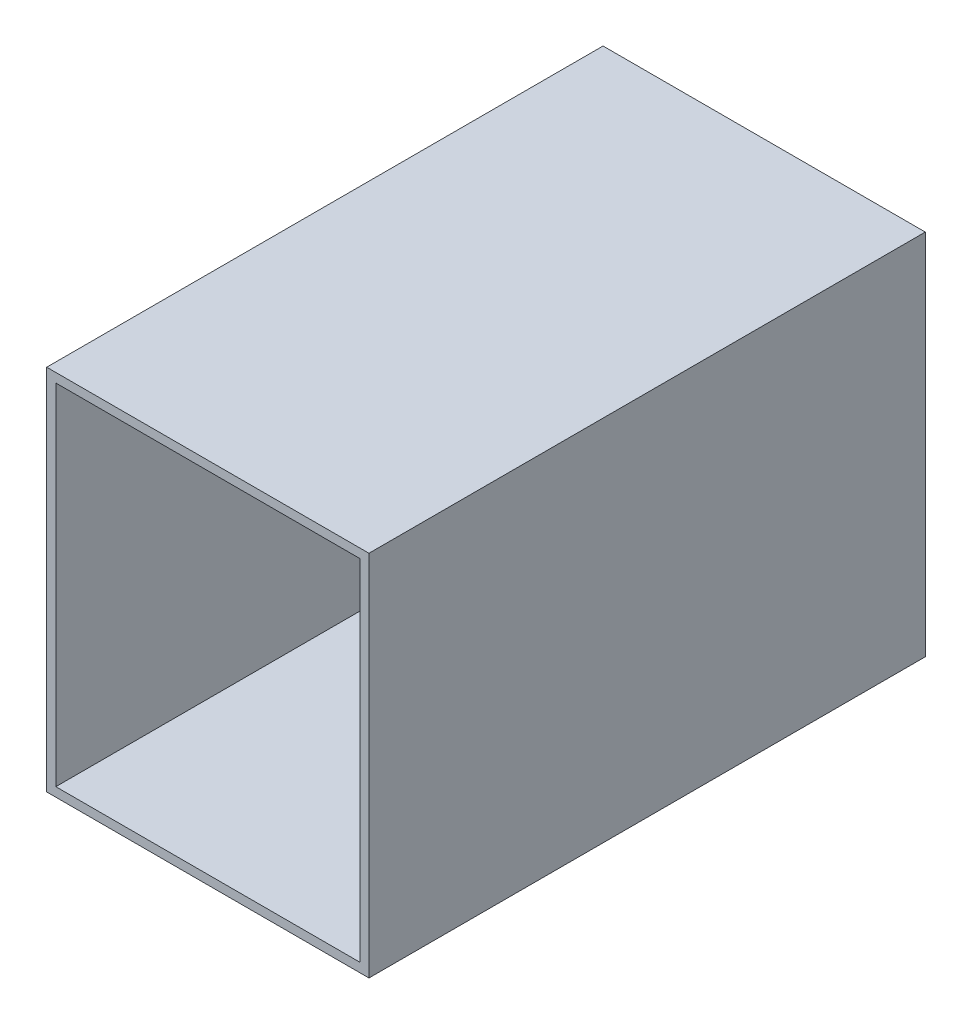
from build123d import *

# Parameters (mm, degrees)
SKETCH_1_W         = 106
SKETCH_1_H         = 121
BLOCKEXTRUDE_DEPTH = 183
SHELL_1_T          = -3


with BuildPart() as part:
    # 草图1 → BlockExtrude (new body)
    with BuildSketch(Plane.XY):
        with Locations((53, 60.5)):
            Rectangle(SKETCH_1_W, SKETCH_1_H)
    extrude(amount=BLOCKEXTRUDE_DEPTH)

    # 抽壳1
    shell_1_openings = [part.faces().sort_by_distance(p)[0] for p in [
        (53, 60.5, 183),
    ]]
    offset(amount=SHELL_1_T, openings=shell_1_openings, kind=Kind.INTERSECTION)


solid = part.part
